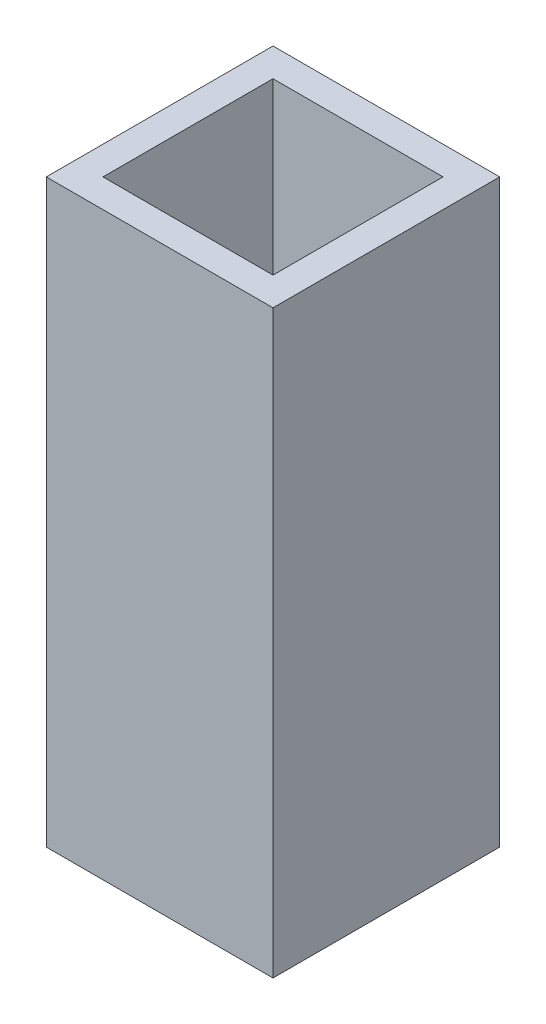
from build123d import *

# Parameters (mm, degrees)
SKETCH1_W           = 25.4
SKETCH1_H           = 25.4
BOSS_EXTRUDE1_DEPTH = 65.024
SKETCH4_W           = 19.05
SKETCH4_H           = 19.05
CUT_EXTRUDE2_DEPTH  = 75.286207172


with BuildPart() as part:
    # Sketch1 → Boss-Extrude1 (new body)
    with BuildSketch(Plane(origin=(0, 0, 0), x_dir=(1, 0, 0), z_dir=(0, 1, 0))):
        with Locations((12.7, 12.7)):
            Rectangle(SKETCH1_W, SKETCH1_H)
    extrude(amount=BOSS_EXTRUDE1_DEPTH)

    # Sketch4 → Cut-Extrude2 (cut, through all)
    with BuildSketch(Plane(origin=(0, 0, 0), x_dir=(-1, 0, 0), z_dir=(0, -1, 0))):
        with Locations((-12.7, 12.7)):
            Rectangle(SKETCH4_W, SKETCH4_H)
    extrude(amount=-CUT_EXTRUDE2_DEPTH, mode=Mode.SUBTRACT)


solid = part.part
